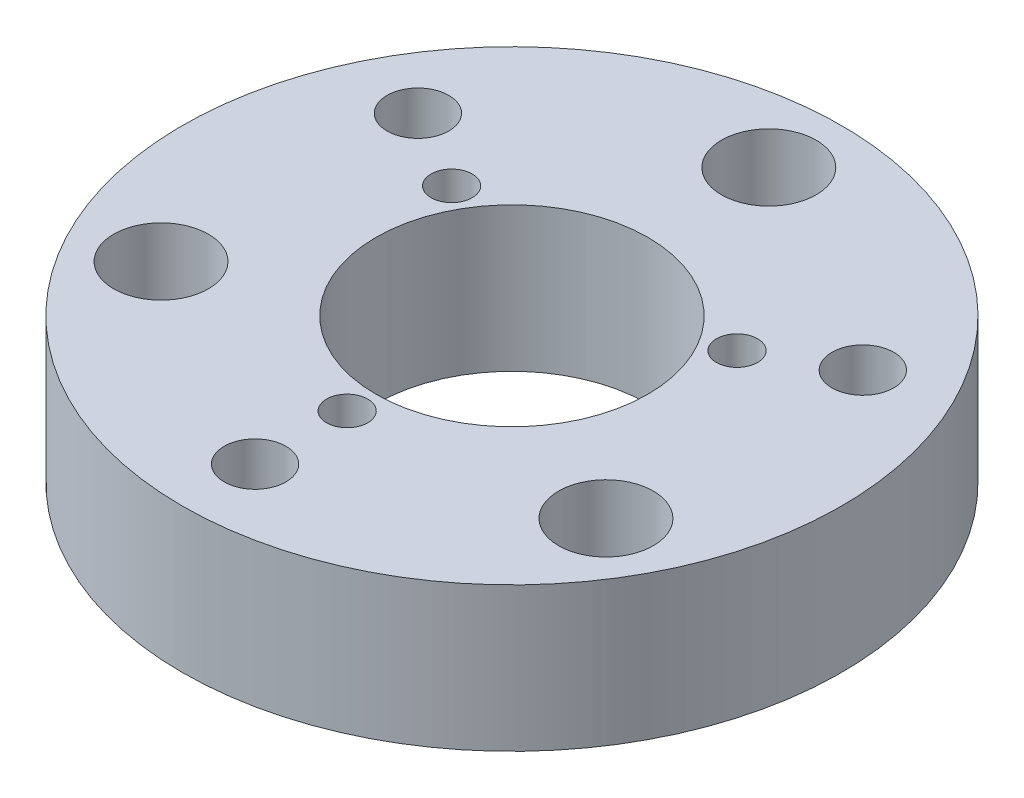
from build123d import *

# Parameters (mm, degrees)
SKETCH_1_R          = 16
SKETCH_1_R_2        = 6.6
SKETCH_1_R_3        = 1.3
EXTRUDE_1_DEPTH     = 7
SKETCH_2_R          = 2.3
CUT_EXTRUDE_2_DEPTH = 5
SKETCH_4_R          = 1
CUT_EXTRUDE_3_DEPTH = 2
SKETCH_5_R          = 1.5
CUT_EXTRUDE_4_DEPTH = 34.400366855
SKETCH_6_R          = 2.65
CUT_EXTRUDE_5_DEPTH = 4


with BuildPart() as part:
    # 草图1 → 凸台-拉伸1 (new body)
    with BuildSketch(Plane(origin=(0, 0, 0), x_dir=(1, 0, 0), z_dir=(0, 1, 0))):
        with Locations(Location((0, -12.470765814, 0), (0, 0, 270))):
            Circle(SKETCH_1_R)
        with Locations(Location((0, -12.470765814, 0), (0, 0, 270))):
            Circle(SKETCH_1_R_2, mode=Mode.SUBTRACT)
        with Locations(Location((-10.8, -18.706148722, 0), (0, 0, 270))):
            Circle(SKETCH_1_R_3, mode=Mode.SUBTRACT)
        with Locations(Location((10.8, -18.706148722, 0), (0, 0, 270))):
            Circle(SKETCH_1_R_3, mode=Mode.SUBTRACT)
        with Locations(Location((0, 0, 0), (0, 0, 270))):
            Circle(SKETCH_1_R_3, mode=Mode.SUBTRACT)
    extrude(amount=EXTRUDE_1_DEPTH)

    # 草图2 → 切除-拉伸2 (cut)
    with BuildSketch(Plane(origin=(0, 7, 0), x_dir=(1, 0, 0), z_dir=(0, 1, 0))):
        with Locations(Location((-10.8, -18.706148722, 0), (0, 0, 270))):
            Circle(SKETCH_2_R)
        with Locations(Location((10.8, -18.706148722, 0), (0, 0, 270))):
            Circle(SKETCH_2_R)
        with Locations(Location((0, 0, 0), (0, 0, 270))):
            Circle(SKETCH_2_R)
    extrude(amount=-CUT_EXTRUDE_2_DEPTH, mode=Mode.SUBTRACT)

    # 草图4 → 切除-拉伸3 (cut)
    with BuildSketch(Plane(origin=(0, 7, 0), x_dir=(1, 0, 0), z_dir=(0, 1, 0))):
        with Locations(Location((-6.92820323, -8.470765814, 0), (0, 0, 270))):
            Circle(SKETCH_4_R)
        with Locations(Location((6.92820323, -8.470765814, 0), (0, 0, 90))):
            Circle(SKETCH_4_R)
        with Locations(Location((0, -20.470765814, 0), (0, 0, 270))):
            Circle(SKETCH_4_R)
    extrude(amount=-CUT_EXTRUDE_3_DEPTH, mode=Mode.SUBTRACT)

    # 草图5 → 切除-拉伸4 (cut, through all)
    with BuildSketch(Plane(origin=(0, 7, 0), x_dir=(1, 0, 0), z_dir=(0, 1, 0))):
        with Locations(Location((-10.8, -6.235382907, 0), (0, 0, 270))):
            Circle(SKETCH_5_R)
        with Locations(Location((10.8, -6.235382907, 0), (0, 0, 270))):
            Circle(SKETCH_5_R)
        with Locations(Location((0, -24.941531629, 0), (0, 0, 270))):
            Circle(SKETCH_5_R)
    extrude(amount=-CUT_EXTRUDE_4_DEPTH, mode=Mode.SUBTRACT)

    # 草图6 → 切除-拉伸5 (cut)
    with BuildSketch(Plane.XZ):
        with Locations(Location((0, 24.941531629, 0), (0, 0, 270))):
            Circle(SKETCH_6_R)
        with Locations(Location((-10.8, 6.235382907, 0), (0, 0, 270))):
            Circle(SKETCH_6_R)
        with Locations(Location((10.8, 6.235382907, 0), (0, 0, 270))):
            Circle(SKETCH_6_R)
    extrude(amount=-CUT_EXTRUDE_5_DEPTH, mode=Mode.SUBTRACT)


solid = part.part
